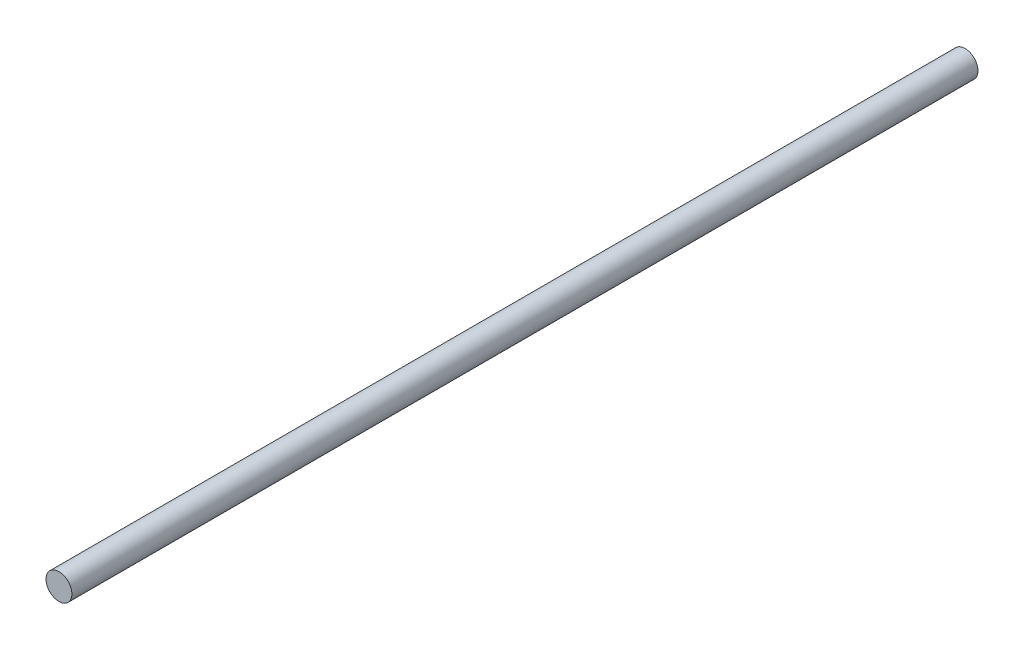
from build123d import *

# Parameters (mm, degrees)
ESQUISSE1_R        = 1.5
BOSS_EXTRU_1_DEPTH = 105


with BuildPart() as part:
    # Esquisse1 → Boss.-Extru.1 (new body)
    with BuildSketch(Plane.XY):
        Circle(ESQUISSE1_R)
    extrude(amount=BOSS_EXTRU_1_DEPTH)


solid = part.part
